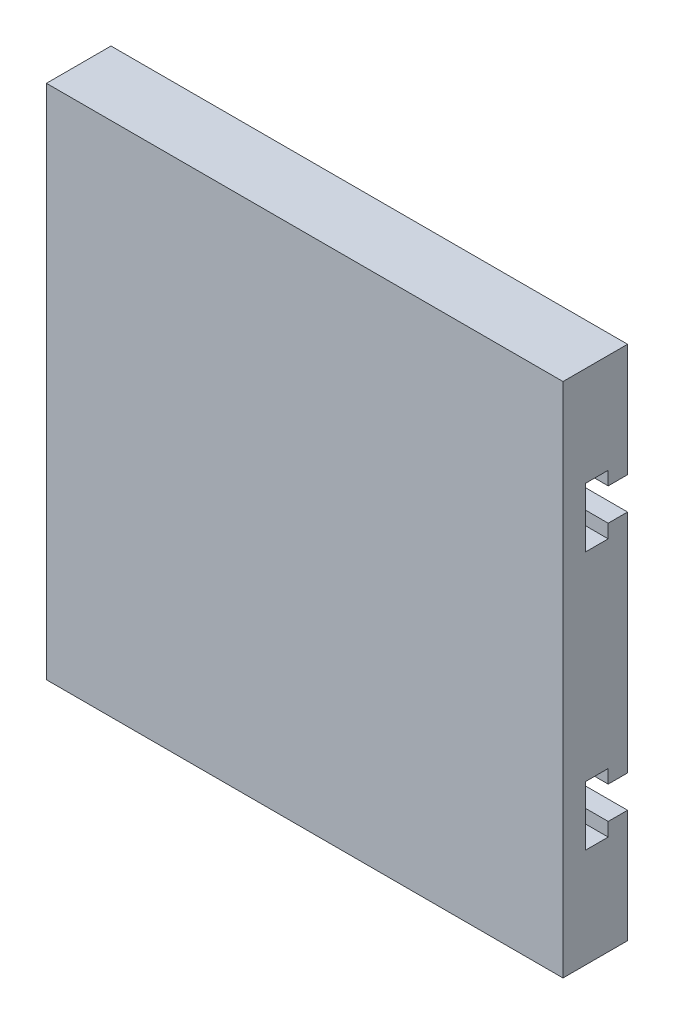
from build123d import *

# Parameters (mm, degrees)
ESQUISSE1_W             = 80
ESQUISSE1_H             = 80
ESQUISSE1_R             = 2.5
BOSS_EXTRU_1_DEPTH      = 10
ESQUISSE2_R             = 4.6
ENL_V_MAT_EXTRU_1_DEPTH = 7
ENL_V_MAT_EXTRU_2_DEPTH = 7.5
ESQUISSE5_R             = 4.6
BOSS_EXTRU_2_DEPTH      = 3.5
SYM_TRIE4_COPY_1_DEPTH  = 7.5


with BuildPart() as part:
    # Esquisse1 → Boss.-Extru.1 (new body)
    with BuildSketch(Plane.XY):
        Rectangle(ESQUISSE1_W, ESQUISSE1_H)
        with Locations((-32.5, 20)):
            Circle(ESQUISSE1_R, mode=Mode.SUBTRACT)
        with Locations((-32.5, -20)):
            Circle(ESQUISSE1_R, mode=Mode.SUBTRACT)
        with Locations((32.5, -20)):
            Circle(ESQUISSE1_R, mode=Mode.SUBTRACT)
        with Locations((32.5, 20)):
            Circle(ESQUISSE1_R, mode=Mode.SUBTRACT)
    extrude(amount=BOSS_EXTRU_1_DEPTH)

    # Esquisse2 → Enlèv. mat.-Extru.1 (cut)
    with BuildSketch(Plane.XY.offset(10)):
        with Locations((-32.5, 20)):
            Circle(ESQUISSE2_R)
        with Locations(Location((-32.5, -20, 0), (0, 0, 180))):
            Circle(ESQUISSE2_R)
        with Locations((32.5, -20)):
            Circle(ESQUISSE2_R)
        with Locations(Location((32.5, 20, 0), (0, 0, 180))):
            Circle(ESQUISSE2_R)
    extrude(amount=-ENL_V_MAT_EXTRU_1_DEPTH, mode=Mode.SUBTRACT)

    # Esquisse4 → Enlèv. mat.-Extru.2 (cut)
    with BuildSketch(Plane.ZY.offset(40)):
        Polygon((6.5, 24.6), (6.5, 15.4), (3, 15.4), (3, 17.5), (0, 17.5), (0, 22.5), (3, 22.5), (3, 24.6), align=None)
    enl_v_mat_extru_2 = extrude(amount=-ENL_V_MAT_EXTRU_2_DEPTH, mode=Mode.SUBTRACT)

    # Symétrie1: Enlèv. mat.-Extru.2 across plane
    add(enl_v_mat_extru_2.mirror(Plane.ZX), mode=Mode.SUBTRACT)

    # Esquisse5 → Boss.-Extru.2 (add)
    with BuildSketch(Plane.XY.offset(10)):
        with Locations((-32.5, 20)):
            Circle(ESQUISSE5_R)
        with Locations(Location((32.5, 20, 0), (0, 0, 90))):
            Circle(ESQUISSE5_R)
        with Locations((32.5, -20)):
            Circle(ESQUISSE5_R)
        with Locations((-32.5, -20)):
            Circle(ESQUISSE5_R)
    extrude(amount=-BOSS_EXTRU_2_DEPTH)

    # Symétrie4: Enlèv. mat.-Extru.2 across plane
    add(enl_v_mat_extru_2.mirror(Plane(origin=(0, 0, 0), x_dir=(0, 0, 1), z_dir=(1, 0, 0))), mode=Mode.SUBTRACT)

    # Symétrie4 copy 1 sketch → Symétrie4 copy 1 (cut)
    with BuildSketch(Plane(origin=(40, 0, 0), x_dir=(0, 0, 1), z_dir=(1, 0, 0))):
        Polygon((6.5, 24.6), (6.5, 15.4), (3, 15.4), (3, 17.5), (0, 17.5), (0, 22.5), (3, 22.5), (3, 24.6), align=None)
    extrude(amount=-SYM_TRIE4_COPY_1_DEPTH, mode=Mode.SUBTRACT)


solid = part.part
